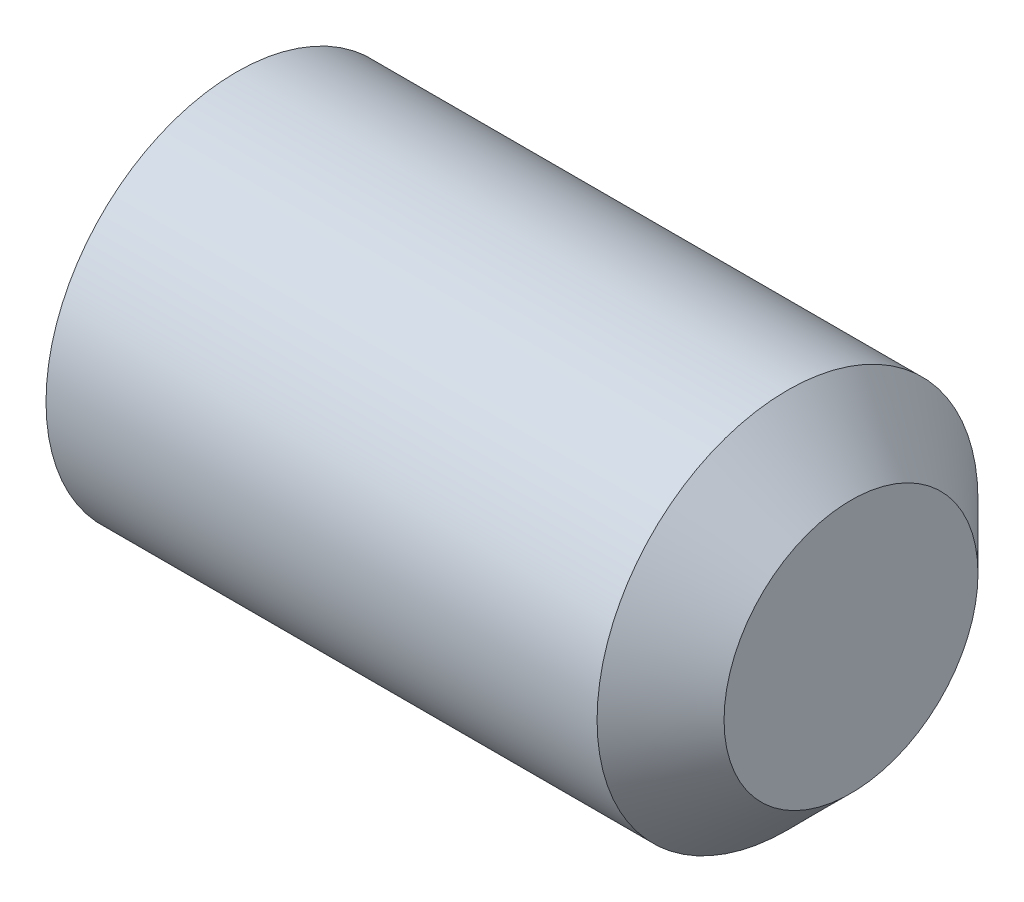
from build123d import *

# Parameters (mm, degrees)
HEX_2_DEPTH = 3.5


with BuildPart() as part:
    # BodySke → BaseBody (revolve)
    with BuildSketch(Plane.XY, mode=Mode.PRIVATE) as basebody_sk:
        Polygon((0, 0), (0, 2.4455), (0.320140724, 3), (9, 3), (10, 2), (10, 0), align=None)
    revolve(basebody_sk.sketch.rotate(Axis((-12.7, 0, 0), (1, 0, 0)), 90), axis=Axis((-12.7, 0, 0), (1, 0, 0)))

    # Sketch2 → Hex 2 (cut)
    with BuildSketch(Plane.ZY):
        Polygon((0.866025404, 1.5), (-0.866025404, 1.5), (-1.732050808, 0), (-0.866025404, -1.5), (0.866025404, -1.5), (1.732050808, 0), align=None)
    extrude(amount=-HEX_2_DEPTH, mode=Mode.SUBTRACT)


solid = part.part
